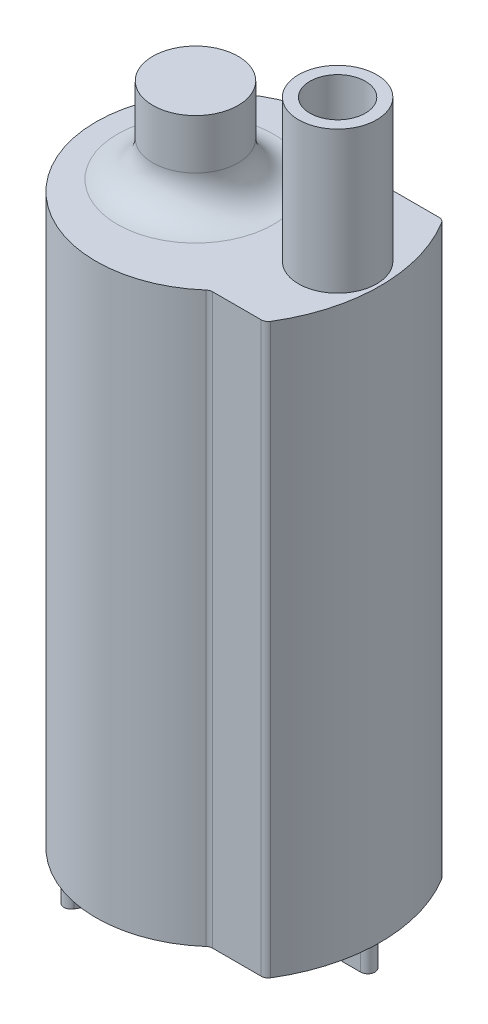
from build123d import *

# Parameters (mm, degrees)
BOSS_EXTRUDE1_DEPTH = 80
SKETCH2_R           = 5.5
SKETCH2_R_2         = 3.9
BOSS_EXTRUDE2_DEPTH = 20
SKETCH3_R           = 6
BOSS_EXTRUDE3_DEPTH = 12
FILLET1_R           = 5
BOSS_EXTRUDE4_DEPTH = 4
FILLET2_R           = 1


with BuildPart() as part:
    # Sketch1 → Boss-Extrude1 (new body)
    with BuildSketch(Plane(origin=(0, 0, 0), x_dir=(1, 0, 0), z_dir=(0, 1, 0))):
        with BuildLine():
            Line((11.521718622, 12.5), (19.306734576, 12.5))
            ThreePointArc((19.306734576, 12.5), (23, 0), (19.306734576, -12.5))
            Line((19.306734576, -12.5), (11.521718622, -12.5))
            ThreePointArc((11.521718622, -12.5), (-17, 0), (11.521718622, 12.5))
        make_face()
    extrude(amount=BOSS_EXTRUDE1_DEPTH)

    # Sketch2 → Boss-Extrude2 (add)
    with BuildSketch(Plane(origin=(0, 80, 0), x_dir=(1, 0, 0), z_dir=(0, 1, 0))):
        with Locations(Location((17, 0, 0), (0, 0, 270))):
            Circle(SKETCH2_R)
        with Locations(Location((17, 0, 0), (0, 0, 270))):
            Circle(SKETCH2_R_2, mode=Mode.SUBTRACT)
    extrude(amount=BOSS_EXTRUDE2_DEPTH)

    # Sketch3 → Boss-Extrude3 (add)
    with BuildSketch(Plane(origin=(0, 80, 0), x_dir=(1, 0, 0), z_dir=(0, 1, 0))):
        with Locations(Location((-3, 0, 0), (0, 0, 270))):
            Circle(SKETCH3_R)
    extrude(amount=BOSS_EXTRUDE3_DEPTH)

    # Fillet1
    fillet1_edges = [part.edges().sort_by_distance(p)[0] for p in [
        (-3, 80, -6),
    ]]
    fillet(fillet1_edges, radius=FILLET1_R)

    # Sketch4 → Boss-Extrude4 (add)
    with BuildSketch(Plane.XZ):
        with BuildLine():
            Line((-7.116025404, 10.325317547), (-8.366025404, 12.490381057))
            ThreePointArc((-8.366025404, 12.490381057), (-8, 13.856406461), (-6.633974596, 13.490381057))
            Line((-6.633974596, 13.490381057), (-5.383974596, 11.325317547))
            ThreePointArc((-5.383974596, 11.325317547), (-5.75, 9.959292144), (-7.116025404, 10.325317547))
        make_face()
        with BuildLine():
            Line((-5.383974596, -11.325317547), (-6.633974596, -13.490381057))
            ThreePointArc((-6.633974596, -13.490381057), (-8, -13.856406461), (-8.366025404, -12.490381057))
            Line((-8.366025404, -12.490381057), (-7.116025404, -10.325317547))
            ThreePointArc((-7.116025404, -10.325317547), (-5.75, -9.959292144), (-5.383974596, -11.325317547))
        make_face()
        with BuildLine():
            Line((18.75, 1), (21.25, 1))
            ThreePointArc((21.25, 1), (22.25, 0), (21.25, -1))
            Line((21.25, -1), (18.75, -1))
            ThreePointArc((18.75, -1), (17.75, 0), (18.75, 1))
        make_face()
    extrude(amount=BOSS_EXTRUDE4_DEPTH)

    # Fillet2
    fillet2_edges = [part.edges().sort_by_distance(p)[0] for p in [
        (11.521718622, 40, -12.5),
        (19.306734576, 40, -12.5),
        (19.306734576, 40, 12.5),
        (11.521718622, 40, 12.5),
    ]]
    fillet(fillet2_edges, radius=FILLET2_R)


solid = part.part
